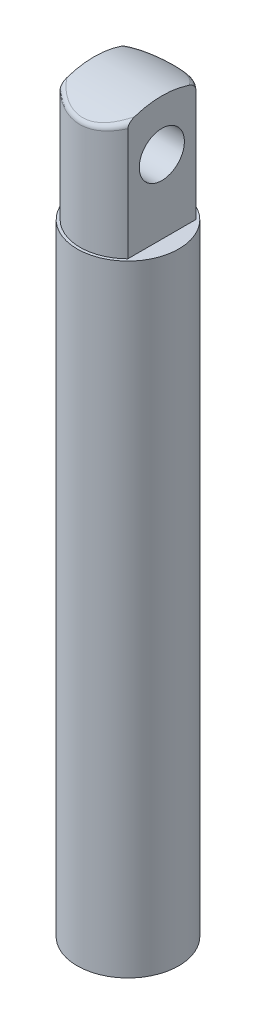
from build123d import *

# Parameters (mm, degrees)
SKETCH_1_R          = 4.5
EXTRUDE_1_DEPTH     = 55
EXTRUDE_2_DEPTH     = 15
SKETCH_4_R          = 2
CUT_EXTRUDE_1_DEPTH = 71.544312315
CUT_EXTRUDE_3_DEPTH = 71.544312315
FILLET_1_R          = 0.5


with BuildPart() as part:
    # 草图1 → 凸台-拉伸1 (new body)
    with BuildSketch(Plane(origin=(0, 0, 0), x_dir=(1, 0, 0), z_dir=(0, 1, 0))):
        with Locations(Location((0, 0, 0), (0, 0, 270))):
            Circle(SKETCH_1_R)
    extrude(amount=EXTRUDE_1_DEPTH)

    # 草图2 → 凸台-拉伸2 (add)
    with BuildSketch(Plane(origin=(0, 55, 0), x_dir=(1, 0, 0), z_dir=(0, 1, 0))):
        with BuildLine():
            Line((-3, 3.010398645), (-3, -3.010398645))
            ThreePointArc((-3, -3.010398645), (0, -4.25), (3, -3.010398645))
            Line((3, -3.010398645), (3, 3.010398645))
            ThreePointArc((3, 3.010398645), (0, 4.25), (-3, 3.010398645))
        make_face()
    extrude(amount=EXTRUDE_2_DEPTH)

    # 草图4 → 切除-拉伸1 (cut, through all)
    with BuildSketch(Plane.ZY.offset(3)):
        with Locations((0, 61.5)):
            Circle(SKETCH_4_R)
    extrude(amount=-CUT_EXTRUDE_1_DEPTH, mode=Mode.SUBTRACT)

    # 草图5 → 切除-拉伸3 (cut, through all)
    with BuildSketch(Plane.ZY.offset(3)):
        with BuildLine():
            Line((-4.813255022, 64.251745482), (-4.813255022, 72.406434262))
            Line((-4.813255022, 72.406434262), (5.466876832, 72.406434262))
            Line((5.466876832, 72.406434262), (5.466876832, 63.634516306))
            ThreePointArc((5.466876832, 63.634516306), (0.449497866, 65.986517994), (-4.813255022, 64.251745482))
        make_face()
    extrude(amount=-CUT_EXTRUDE_3_DEPTH, mode=Mode.SUBTRACT)

    # 圆角1
    fillet_1_edges = [part.edges().sort_by_distance(p)[0] for p in [
        (0, 64.679603547, -4.25),
        (0, 64.679603547, 4.25),
    ]]
    fillet(fillet_1_edges, radius=FILLET_1_R)


solid = part.part
